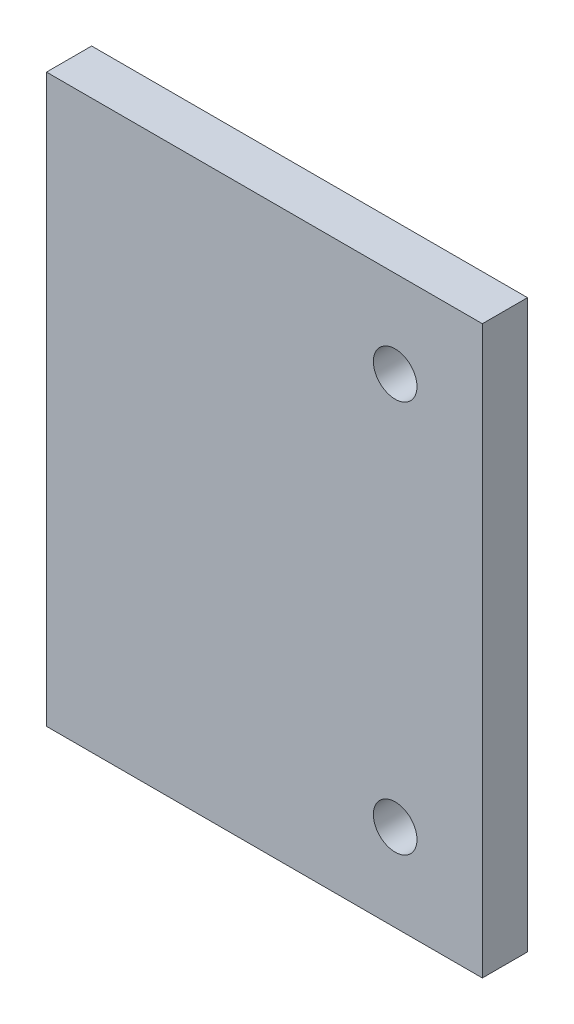
from build123d import *

# Parameters (mm, degrees)
SKETCH1_W                  = 63.5
SKETCH1_H                  = 82.55
BOSS_EXTRUDE1_DEPTH        = 3.2893
F_97_0_25_DIAMETER_HOLE2_D = 6.35


with BuildPart() as part:
    # Sketch1 → Boss-Extrude1 (new, symmetric)
    with BuildSketch(Plane.XY):
        Rectangle(SKETCH1_W, SKETCH1_H)
    extrude(amount=BOSS_EXTRUDE1_DEPTH, both=True)

    # #97 (0.25) Diameter Hole2 (through all)
    with Locations(Plane(origin=(19.05, 28.575, 3.2893), x_dir=(1, 0, 0), z_dir=(0, 0, 1))):
        with Locations((0, 0), (0, -57.15)):
            Hole(F_97_0_25_DIAMETER_HOLE2_D / 2)


solid = part.part
